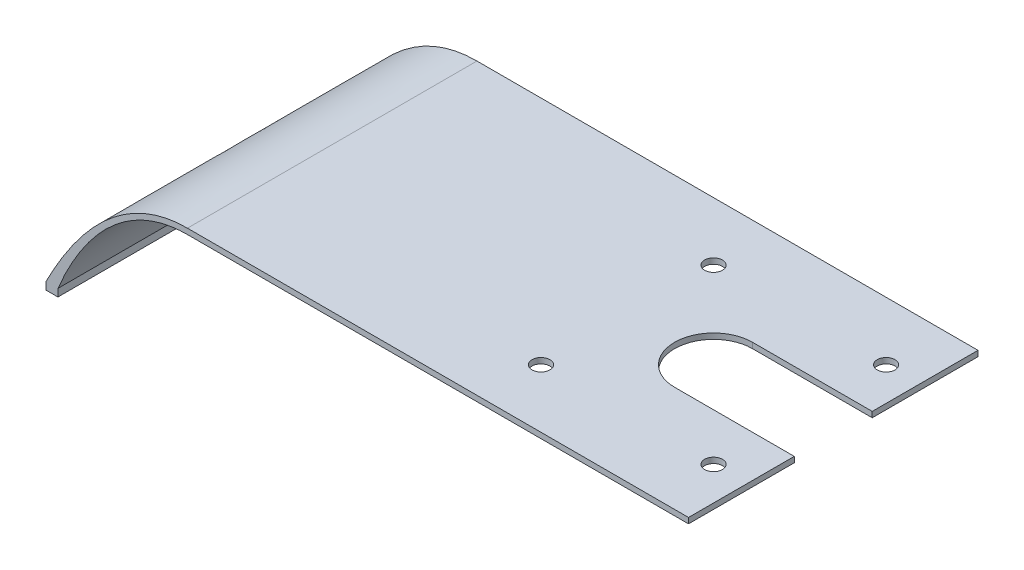
from build123d import *

# Parameters (mm, degrees)
EXTRUDE_1_DEPTH     = 52
SKETCH_3_R          = 1.6
CUT_EXTRUDE_1_DEPTH = 52


with BuildPart() as part:
    # 草图2 → 凸台-拉伸1 (new body)
    with BuildSketch(Plane.XY):
        with BuildLine():
            Line((0, 21), (90, 21))
            Line((90, 21), (90, 20))
            Line((90, 20), (0, 20))
            add(Edge.make_bspline(
                [(0, 20), (-11.918826451, 20), (-19.365080243, 9.425379896), (-23.265119014, 0)],
                knots=[0, 0, 0, 0, 1, 1, 1, 1], degree=3))
            Line((-23.265119014, 0), (-23.265119014, -1.344088089))
            Line((-23.265119014, -1.344088089), (-25.409868427, -1.344088089))
            Line((-25.409868427, -1.344088089), (-25.409868427, 0))
            add(Edge.make_bspline(
                [(0, 21), (-12.514575739, 21), (-20.585292942, 9.393477036), (-25.409868427, 0)],
                knots=[0, 0, 0, 0, 1, 1, 1, 1], degree=3))
        make_face()
    extrude(amount=EXTRUDE_1_DEPTH)

    # 草图3 → 切除-拉伸1 (cut)
    with BuildSketch(Plane(origin=(0, 21, 0), x_dir=(1, 0, 0), z_dir=(0, 1, 0))):
        with Locations(Location((84, -10.5, 0), (0, 0, 270))):
            Circle(SKETCH_3_R)
        with Locations(Location((84, -41.5, 0), (0, 0, 270))):
            Circle(SKETCH_3_R)
        with Locations(Location((53, -41.5, 0), (0, 0, 270))):
            Circle(SKETCH_3_R)
        with Locations(Location((53, -10.5, 0), (0, 0, 270))):
            Circle(SKETCH_3_R)
        with BuildLine():
            Line((90, -19), (68.5, -19))
            ThreePointArc((68.5, -19), (61.5, -26), (68.5, -33))
            Line((68.5, -33), (90, -33))
            Line((90, -33), (90, -19))
        make_face()
    extrude(amount=-CUT_EXTRUDE_1_DEPTH, mode=Mode.SUBTRACT)


solid = part.part
